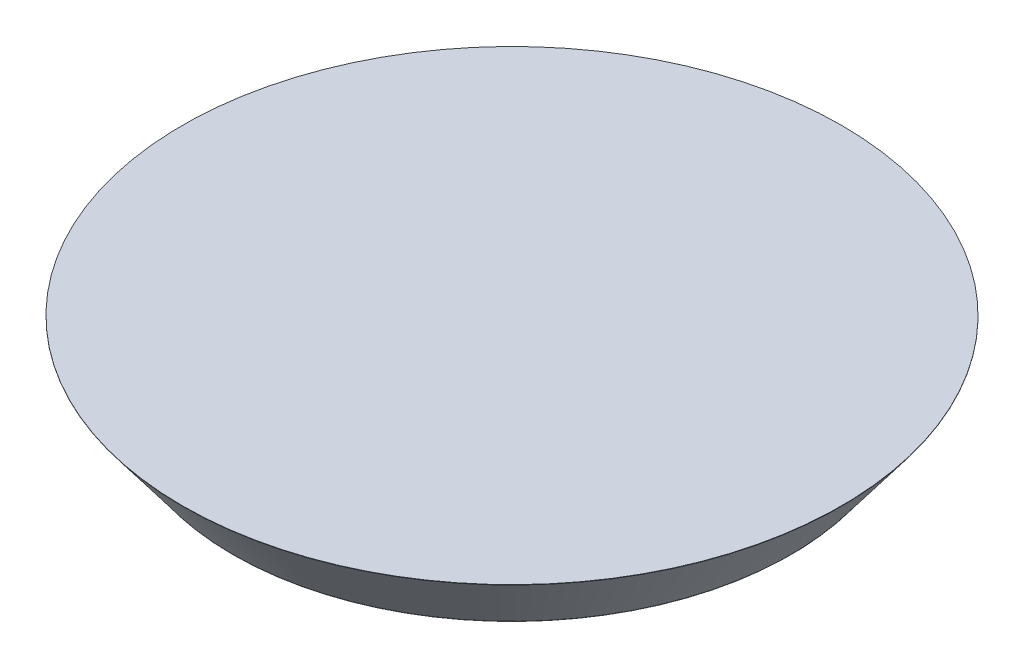
from build123d import *

# Parameters (mm, degrees)
SKETCH1_R               = 48.8061
EXTRUDE1_DEPTH          = 6.5024
CHAMFER2_SIZE           = 7.50062
CHAMFER2_SIZE2          = 9.95365893
SKETCH6_R               = 41.30548
SKETCH6_R_2             = 40.79748
EXTRUDE_THIN2_DEPTH     = 0.0254
CUT_EXTRUDE1_DEPTH      = 70.330245689
CUT_EXTRUDE1_DEPTH_BACK = 70.330245689
SKETCH7_W               = 97.6122
SKETCH7_H               = 2.9972


with BuildPart() as part:
    # Sketch1 → Extrude1 (new, symmetric)
    with BuildSketch(Plane(origin=(0, 0, 0), x_dir=(1, 0, 0), z_dir=(0, 1, 0))):
        with Locations(Location((0, 0, 0), (0, 0, 270))):
            Circle(SKETCH1_R)
    extrude(amount=EXTRUDE1_DEPTH, both=True)

    # Chamfer2
    chamfer2_edges = [part.edges().sort_by_distance(p)[0] for p in [
        (0, -6.5024, -48.8061),
    ]]
    chamfer2_side = [part.faces().sort_by_distance(p)[0] for p in [
        (0, -6.5024, 0),
    ]]
    chamfer(chamfer2_edges, length=CHAMFER2_SIZE, length2=CHAMFER2_SIZE2, reference=chamfer2_side[0])

    # Sketch6 → Extrude-Thin2 (add)
    with BuildSketch(Plane.XZ.offset(6.5024)):
        Circle(SKETCH6_R)
        Circle(SKETCH6_R_2, mode=Mode.SUBTRACT)
    extrude(amount=EXTRUDE_THIN2_DEPTH)

    # Sketch7 → Cut-Extrude1 (cut, two sides: drawn at the far end of the back side and taken through both)
    with BuildSketch(Plane(origin=(0, 0, 0), x_dir=(0, 0, -1), z_dir=(1, 0, 0)).offset(-CUT_EXTRUDE1_DEPTH_BACK)):
        with Locations((0, 5.0038)):
            Rectangle(SKETCH7_W, SKETCH7_H)
    extrude(amount=CUT_EXTRUDE1_DEPTH + CUT_EXTRUDE1_DEPTH_BACK, mode=Mode.SUBTRACT)


solid = part.part
